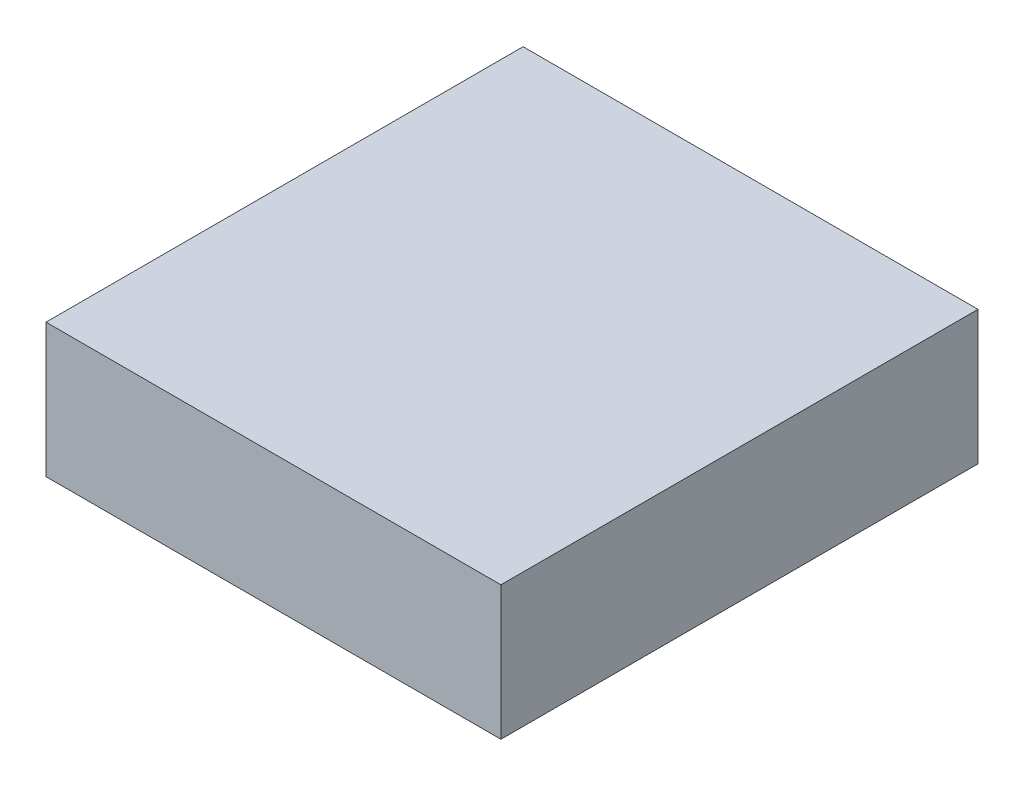
from build123d import *

# Parameters (mm, degrees)
SKETCH1_W           = 64.6
SKETCH1_H           = 67.75
BOSS_EXTRUDE1_DEPTH = 19


with BuildPart() as part:
    # Sketch1 → Boss-Extrude1 (new body)
    with BuildSketch(Plane(origin=(0, 0, 0), x_dir=(1, 0, 0), z_dir=(0, 1, 0))):
        Rectangle(SKETCH1_W, SKETCH1_H)
    extrude(amount=BOSS_EXTRUDE1_DEPTH)


solid = part.part
